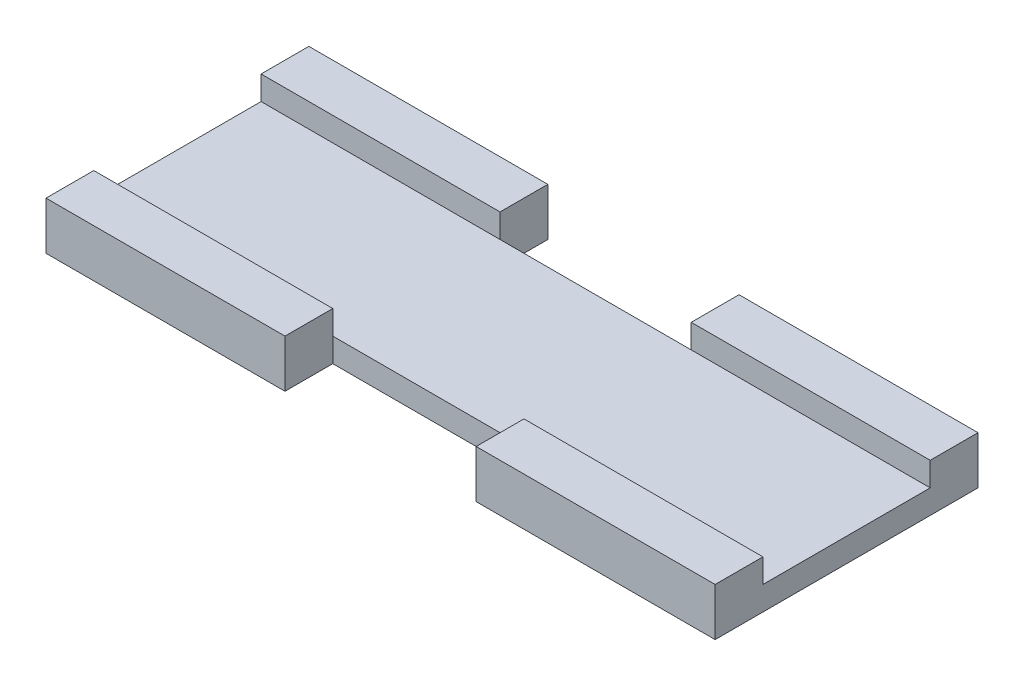
from build123d import *

# Parameters (mm, degrees)
EXTRUDE_1_DEPTH = 5
SKETCH_1_3_W    = 50
SKETCH_1_3_H    = 10
EXTRUDE_2_DEPTH = 10


with BuildPart() as part:
    # Эскиз1 → Бобышка-Вытянуть1 (new body)
    with BuildSketch(Plane(origin=(0, 0, 0), x_dir=(1, 0, 0), z_dir=(0, 1, 0))):
        Polygon((-70, 17.5), (-70, -17.5), (-20, -17.5), (20, -17.5), (70, -17.5), (70, 17.5), (20, 17.5), (-20, 17.5), align=None)
    extrude(amount=EXTRUDE_1_DEPTH)

    # Эскиз1<3> → Бобышка-Вытянуть2 (add)
    with BuildSketch(Plane(origin=(0, 0, 0), x_dir=(1, 0, 0), z_dir=(0, 1, 0))):
        with Locations((-45, -22.5)):
            Rectangle(SKETCH_1_3_W, SKETCH_1_3_H)
        with Locations((-45, 22.5)):
            Rectangle(SKETCH_1_3_W, SKETCH_1_3_H)
        with Locations((45, -22.5)):
            Rectangle(SKETCH_1_3_W, SKETCH_1_3_H)
        with Locations((45, 22.5)):
            Rectangle(SKETCH_1_3_W, SKETCH_1_3_H)
    extrude(amount=EXTRUDE_2_DEPTH)


solid = part.part
